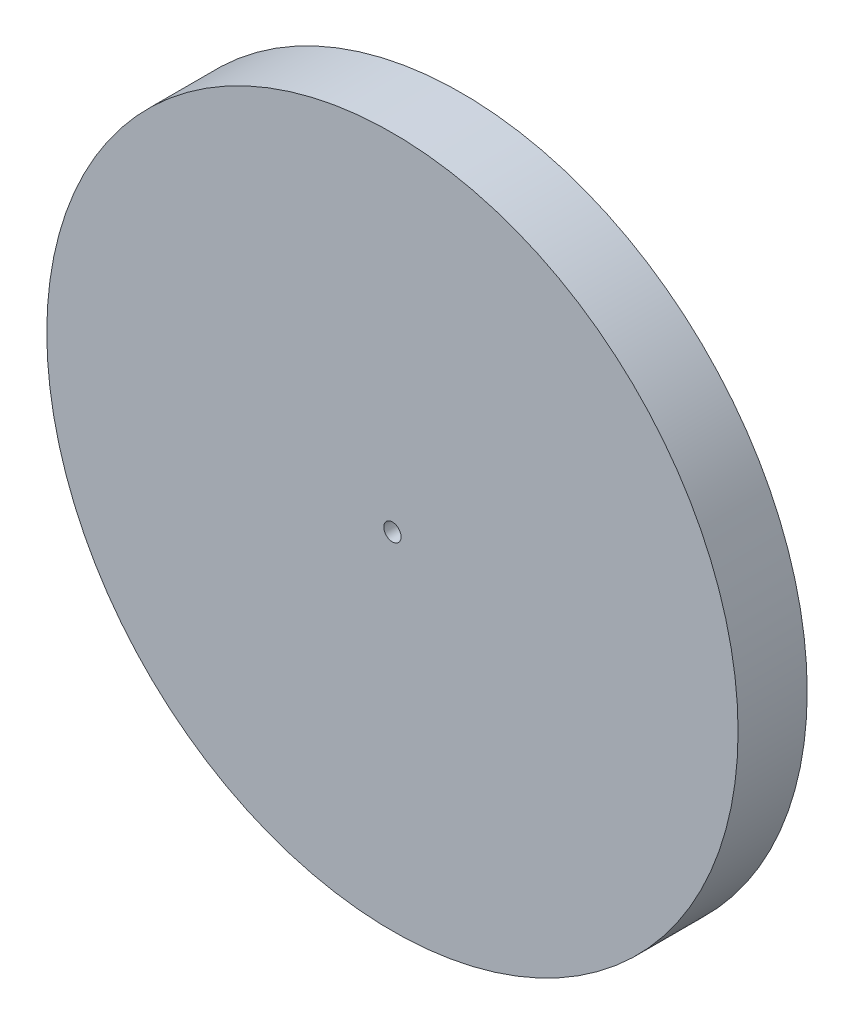
from build123d import *

# Parameters (mm, degrees)
SKETCH1_R           = 127
SKETCH1_R_2         = 3.175
BOSS_EXTRUDE3_DEPTH = 25.4
SKETCH2_R           = 6.35
CUT_EXTRUDE1_DEPTH  = 7.62


with BuildPart() as part:
    # Sketch1 → Boss-Extrude3 (new body)
    with BuildSketch(Plane.XY):
        with Locations((-20.52205738, 15.05590191)):
            Circle(SKETCH1_R)
        with Locations((-20.52205738, 15.05590191)):
            Circle(SKETCH1_R_2, mode=Mode.SUBTRACT)
    extrude(amount=BOSS_EXTRUDE3_DEPTH)

    # Sketch2 → Cut-Extrude1 (cut)
    with BuildSketch(Plane(origin=(0, 0, 0), x_dir=(-1, 0, 0), z_dir=(0, 0, -1))):
        with Locations((20.52205738, 15.05590191)):
            Circle(SKETCH2_R)
    extrude(amount=-CUT_EXTRUDE1_DEPTH, mode=Mode.SUBTRACT)


solid = part.part
